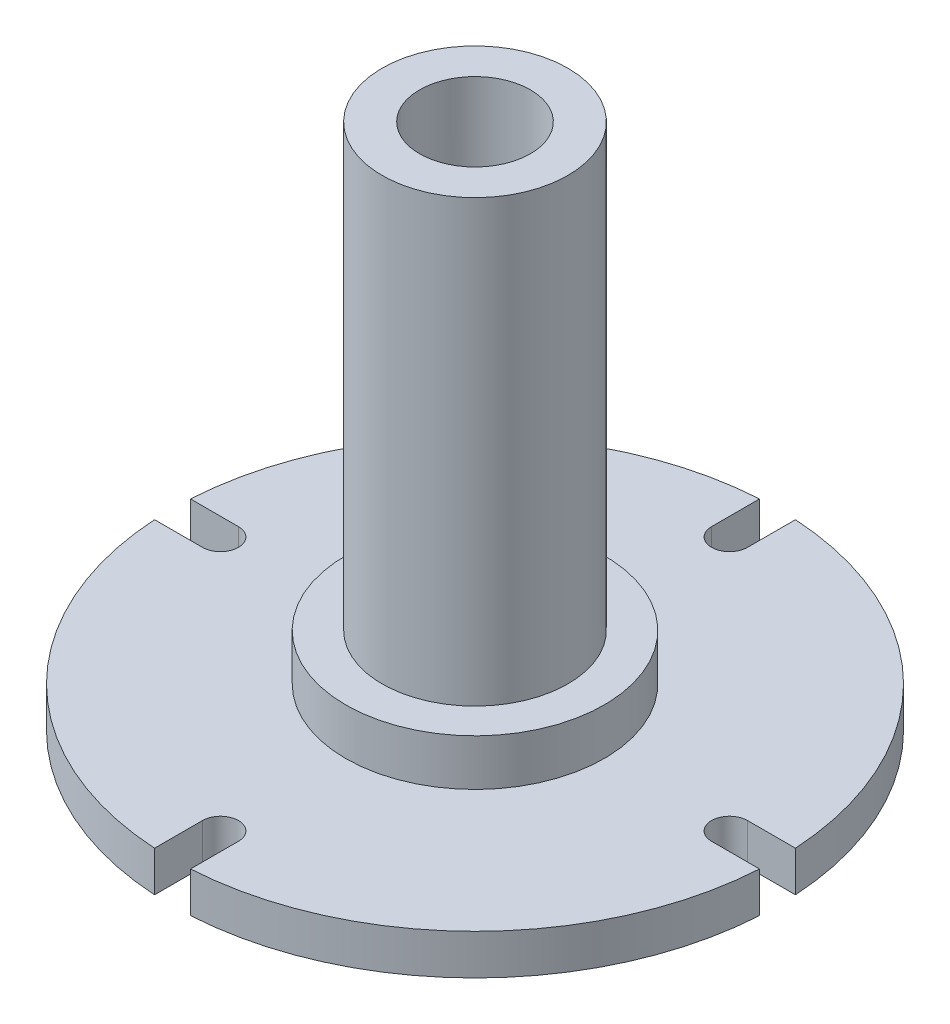
from build123d import *

# Parameters (mm, degrees)
CUT_EXTRUDE1_DEPTH     = 54.343814074
CIRPATTERN1_COUNT      = 4
SKETCH7_R              = 0.5
BOSS_EXTRUDE1_DEPTH    = 12
BOSS_EXTRUDE1_2_DEPTH  = 12
BOSS_EXTRUDE1_3_DEPTH  = 12
BOSS_EXTRUDE1_4_DEPTH  = 12
BOSS_EXTRUDE1_5_DEPTH  = 12
BOSS_EXTRUDE1_6_DEPTH  = 12
BOSS_EXTRUDE1_7_DEPTH  = 12
BOSS_EXTRUDE1_8_DEPTH  = 12
BOSS_EXTRUDE1_9_DEPTH  = 12
BOSS_EXTRUDE1_10_DEPTH = 12
BOSS_EXTRUDE1_11_DEPTH = 12
BOSS_EXTRUDE1_12_DEPTH = 12
SKETCH8_R              = 11.5
SKETCH8_R_2            = 6.858
BOSS_EXTRUDE3_DEPTH    = 54.5
SKETCH9_R              = 6.858
SKETCH9_R_2            = 5
BOSS_EXTRUDE4_DEPTH    = 40.64


with BuildPart() as part:
    # Sketch2 → Revolve1 (revolve)
    with BuildSketch(Plane.XY, mode=Mode.PRIVATE) as revolve1_sk:
        Polygon((0, 0), (37.5, 0), (37.5, 5), (16, 5), (16, 10.75), (0, 10.75), align=None)
    revolve(revolve1_sk.sketch.rotate(Axis((0, 10.75, 0), (0, -1, 0)), 90), axis=Axis((0, 10.75, 0), (0, -1, 0)))

    # Sketch4 → 1/4 NPT Tapped Hole1 (revolve, cut)
    with BuildSketch(Plane(origin=(0, 0, 0), x_dir=(0, 0, -1), z_dir=(1, 0, 0))):
        Polygon((0, 0), (0, 10.75), (5.5626, 10.75), (5.5626, 10.0203), (6.557978799, 10.0203), (6.858, 0), align=None)
    revolve(axis=Axis((0, -6.35, 0), (0, 1, 0)), mode=Mode.SUBTRACT)

    # Sketch5 → Cut-Extrude1 (cut, through all)
    with BuildSketch(Plane(origin=(0, 5, 0), x_dir=(1, 0, 0), z_dir=(0, 1, 0))):
        with BuildLine():
            Line((2.225, 37.5), (2.225, 31.5))
            ThreePointArc((2.225, 31.5), (0, 29.275), (-2.225, 31.5))
            Line((-2.225, 31.5), (-2.225, 37.5))
            ThreePointArc((-2.225, 37.5), (0, 39.725), (2.225, 37.5))
        make_face()
    cut_extrude1 = extrude(amount=-CUT_EXTRUDE1_DEPTH, mode=Mode.SUBTRACT)

    # CirPattern1: Cut-Extrude1 ×4 about axis
    cirpattern1_axis = Axis((0, 0, 0), (0, 1, 0))
    for i in range(1, CIRPATTERN1_COUNT):
        add(cut_extrude1.rotate(cirpattern1_axis, i * 360 / CIRPATTERN1_COUNT), mode=Mode.SUBTRACT)


with BuildPart() as body_2:
    # Sketch7 → Boss-Extrude1 (new body)
    with BuildSketch(Plane.XZ):
        with Locations(Location((-11.75, 6.5, 0), (0, 0, 270))):
            Circle(SKETCH7_R)
    extrude(amount=BOSS_EXTRUDE1_DEPTH)


with BuildPart() as body_3:
    # Sketch7 → Boss-Extrude1 2 (new body)
    with BuildSketch(Plane.XZ):
        with Locations(Location((-11.75, 3.9, 0), (0, 0, 270))):
            Circle(SKETCH7_R)
    extrude(amount=BOSS_EXTRUDE1_2_DEPTH)


with BuildPart() as body_4:
    # Sketch7 → Boss-Extrude1 3 (new body)
    with BuildSketch(Plane.XZ):
        with Locations(Location((-11.75, 1.3, 0), (0, 0, 270))):
            Circle(SKETCH7_R)
    extrude(amount=BOSS_EXTRUDE1_3_DEPTH)


with BuildPart() as body_5:
    # Sketch7 → Boss-Extrude1 4 (new body)
    with BuildSketch(Plane.XZ):
        with Locations(Location((-11.75, -1.3, 0), (0, 0, 270))):
            Circle(SKETCH7_R)
    extrude(amount=BOSS_EXTRUDE1_4_DEPTH)


with BuildPart() as body_6:
    # Sketch7 → Boss-Extrude1 5 (new body)
    with BuildSketch(Plane.XZ):
        with Locations(Location((-11.75, -3.9, 0), (0, 0, 270))):
            Circle(SKETCH7_R)
    extrude(amount=BOSS_EXTRUDE1_5_DEPTH)


with BuildPart() as body_7:
    # Sketch7 → Boss-Extrude1 6 (new body)
    with BuildSketch(Plane.XZ):
        with Locations(Location((-11.75, -6.5, 0), (0, 0, 270))):
            Circle(SKETCH7_R)
    extrude(amount=BOSS_EXTRUDE1_6_DEPTH)


with BuildPart() as body_8:
    # Sketch7 → Boss-Extrude1 7 (new body)
    with BuildSketch(Plane.XZ):
        with Locations(Location((11.75, -6.5, 0), (0, 0, 90))):
            Circle(SKETCH7_R)
    extrude(amount=BOSS_EXTRUDE1_7_DEPTH)


with BuildPart() as body_9:
    # Sketch7 → Boss-Extrude1 8 (new body)
    with BuildSketch(Plane.XZ):
        with Locations(Location((11.75, -3.9, 0), (0, 0, 90))):
            Circle(SKETCH7_R)
    extrude(amount=BOSS_EXTRUDE1_8_DEPTH)


with BuildPart() as body_10:
    # Sketch7 → Boss-Extrude1 9 (new body)
    with BuildSketch(Plane.XZ):
        with Locations(Location((11.75, -1.3, 0), (0, 0, 90))):
            Circle(SKETCH7_R)
    extrude(amount=BOSS_EXTRUDE1_9_DEPTH)


with BuildPart() as body_11:
    # Sketch7 → Boss-Extrude1 10 (new body)
    with BuildSketch(Plane.XZ):
        with Locations(Location((11.75, 1.3, 0), (0, 0, 90))):
            Circle(SKETCH7_R)
    extrude(amount=BOSS_EXTRUDE1_10_DEPTH)


with BuildPart() as body_12:
    # Sketch7 → Boss-Extrude1 11 (new body)
    with BuildSketch(Plane.XZ):
        with Locations(Location((11.75, 3.9, 0), (0, 0, 90))):
            Circle(SKETCH7_R)
    extrude(amount=BOSS_EXTRUDE1_11_DEPTH)


with BuildPart() as body_13:
    # Sketch7 → Boss-Extrude1 12 (new body)
    with BuildSketch(Plane.XZ):
        with Locations(Location((11.75, 6.5, 0), (0, 0, 90))):
            Circle(SKETCH7_R)
    extrude(amount=BOSS_EXTRUDE1_12_DEPTH)


with BuildPart() as body_14:
    # Sketch8 → Boss-Extrude3 (new body)
    with BuildSketch(Plane.XZ.offset(-10.75)):
        with Locations(Location((0, 0, 0), (0, 0, 270))):
            Circle(SKETCH8_R)
        with Locations(Location((0, 0, 0), (0, 0, 270))):
            Circle(SKETCH8_R_2, mode=Mode.SUBTRACT)
    extrude(amount=-BOSS_EXTRUDE3_DEPTH)

    # Sketch9 → Boss-Extrude4 (add)
    with BuildSketch(Plane(origin=(0, 10.75, 0), x_dir=(1, 0, 0), z_dir=(0, 1, 0))):
        with Locations(Location((0, 0, 0), (0, 0, 90))):
            Circle(SKETCH9_R)
        with Locations(Location((0, 0, 0), (0, 0, 270))):
            Circle(SKETCH9_R_2, mode=Mode.SUBTRACT)
    extrude(amount=BOSS_EXTRUDE4_DEPTH)


solid = Compound([part.part, body_2.part, body_3.part, body_4.part, body_5.part, body_6.part, body_7.part, body_8.part, body_9.part, body_10.part, body_11.part, body_12.part, body_13.part, body_14.part])
